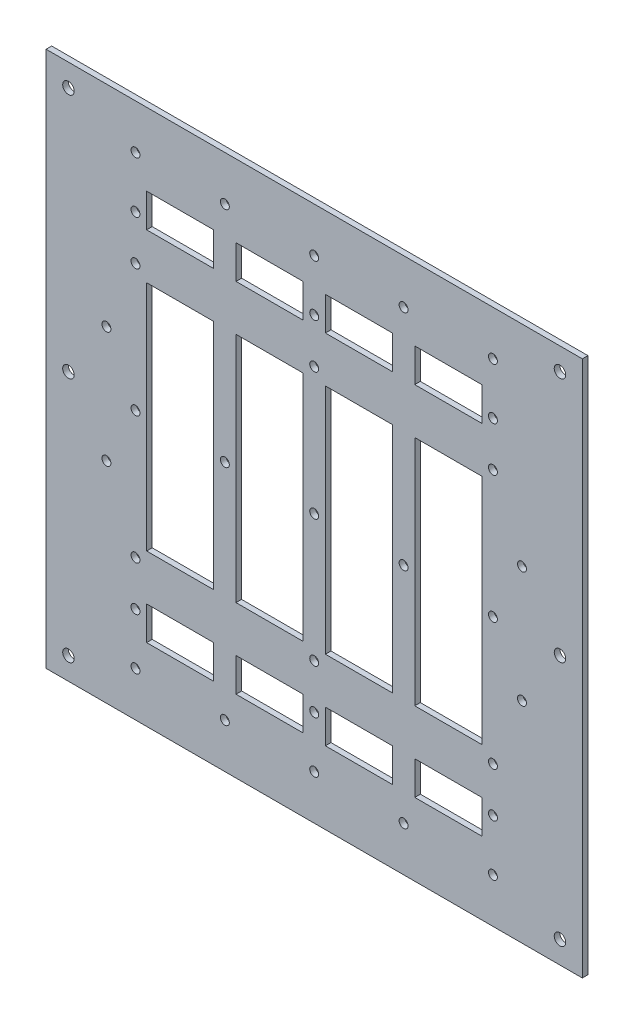
from build123d import *

# Parameters (mm, degrees)
SKETCH1_W           = 304.8
SKETCH1_H           = 304.8
SKETCH1_R           = 2.54
SKETCH1_R_2         = 3.2639
SKETCH1_W_2         = 38.1
SKETCH1_H_2         = 132.08
SKETCH1_H_3         = 19.05
BOSS_EXTRUDE1_DEPTH = 3.175


with BuildPart() as part:
    # Sketch1 → Boss-Extrude1 (new body)
    with BuildSketch(Plane.XY):
        Rectangle(SKETCH1_W, SKETCH1_H)
        with Locations((-101.6, 0)):
            Circle(SKETCH1_R, mode=Mode.SUBTRACT)
        with Locations((-50.8, 0)):
            Circle(SKETCH1_R, mode=Mode.SUBTRACT)
        Circle(SKETCH1_R, mode=Mode.SUBTRACT)
        with Locations((101.6, 0)):
            Circle(SKETCH1_R, mode=Mode.SUBTRACT)
        with Locations((50.8, 0)):
            Circle(SKETCH1_R, mode=Mode.SUBTRACT)
        with Locations((-50.8, 127)):
            Circle(SKETCH1_R, mode=Mode.SUBTRACT)
        with Locations((0, 127)):
            Circle(SKETCH1_R, mode=Mode.SUBTRACT)
        with Locations((50.8, 127)):
            Circle(SKETCH1_R, mode=Mode.SUBTRACT)
        with Locations((-101.6, 72.39)):
            Circle(SKETCH1_R, mode=Mode.SUBTRACT)
        with Locations((0, 72.39)):
            Circle(SKETCH1_R, mode=Mode.SUBTRACT)
        with Locations((101.6, 72.39)):
            Circle(SKETCH1_R, mode=Mode.SUBTRACT)
        with Locations((-101.6, -72.39)):
            Circle(SKETCH1_R, mode=Mode.SUBTRACT)
        with Locations((0, -72.39)):
            Circle(SKETCH1_R, mode=Mode.SUBTRACT)
        with Locations((101.6, -72.39)):
            Circle(SKETCH1_R, mode=Mode.SUBTRACT)
        with Locations((50.8, -127)):
            Circle(SKETCH1_R, mode=Mode.SUBTRACT)
        with Locations((0, -127)):
            Circle(SKETCH1_R, mode=Mode.SUBTRACT)
        with Locations((-50.8, -127)):
            Circle(SKETCH1_R, mode=Mode.SUBTRACT)
        with Locations((-101.6, 97.79)):
            Circle(SKETCH1_R, mode=Mode.SUBTRACT)
        with Locations((0, 97.79)):
            Circle(SKETCH1_R, mode=Mode.SUBTRACT)
        with Locations((101.6, 97.79)):
            Circle(SKETCH1_R, mode=Mode.SUBTRACT)
        with Locations((101.6, 127)):
            Circle(SKETCH1_R, mode=Mode.SUBTRACT)
        with Locations((-101.6, 127)):
            Circle(SKETCH1_R, mode=Mode.SUBTRACT)
        with Locations((-118.11, 33.02)):
            Circle(SKETCH1_R, mode=Mode.SUBTRACT)
        with Locations((-101.6, -127)):
            Circle(SKETCH1_R, mode=Mode.SUBTRACT)
        with Locations((101.6, -127)):
            Circle(SKETCH1_R, mode=Mode.SUBTRACT)
        with Locations((101.6, -97.79)):
            Circle(SKETCH1_R, mode=Mode.SUBTRACT)
        with Locations((0, -97.79)):
            Circle(SKETCH1_R, mode=Mode.SUBTRACT)
        with Locations((-101.6, -97.79)):
            Circle(SKETCH1_R, mode=Mode.SUBTRACT)
        with Locations((-118.11, -33.02)):
            Circle(SKETCH1_R, mode=Mode.SUBTRACT)
        with Locations((-139.7, 139.7)):
            Circle(SKETCH1_R_2, mode=Mode.SUBTRACT)
        with Locations((-139.7, 0)):
            Circle(SKETCH1_R_2, mode=Mode.SUBTRACT)
        with Locations((-139.7, -139.7)):
            Circle(SKETCH1_R_2, mode=Mode.SUBTRACT)
        with Locations((139.7, -139.7)):
            Circle(SKETCH1_R_2, mode=Mode.SUBTRACT)
        with Locations((139.7, 0)):
            Circle(SKETCH1_R_2, mode=Mode.SUBTRACT)
        with Locations((139.7, 139.7)):
            Circle(SKETCH1_R_2, mode=Mode.SUBTRACT)
        with Locations((118.11, -33.02)):
            Circle(SKETCH1_R, mode=Mode.SUBTRACT)
        with Locations((118.11, 33.02)):
            Circle(SKETCH1_R, mode=Mode.SUBTRACT)
        with Locations((-76.2, 0)):
            Rectangle(SKETCH1_W_2, SKETCH1_H_2, mode=Mode.SUBTRACT)
        with Locations((-25.4, 0)):
            Rectangle(SKETCH1_W_2, SKETCH1_H_2, mode=Mode.SUBTRACT)
        with Locations((25.4, 0)):
            Rectangle(SKETCH1_W_2, SKETCH1_H_2, mode=Mode.SUBTRACT)
        with Locations((76.2, 0)):
            Rectangle(SKETCH1_W_2, SKETCH1_H_2, mode=Mode.SUBTRACT)
        with Locations((-25.4, 101.6)):
            Rectangle(SKETCH1_W_2, SKETCH1_H_3, mode=Mode.SUBTRACT)
        with Locations((-76.2, 101.6)):
            Rectangle(SKETCH1_W_2, SKETCH1_H_3, mode=Mode.SUBTRACT)
        with Locations((76.2, 101.6)):
            Rectangle(SKETCH1_W_2, SKETCH1_H_3, mode=Mode.SUBTRACT)
        with Locations((25.4, 101.6)):
            Rectangle(SKETCH1_W_2, SKETCH1_H_3, mode=Mode.SUBTRACT)
        with Locations((-76.2, -101.6)):
            Rectangle(SKETCH1_W_2, SKETCH1_H_3, mode=Mode.SUBTRACT)
        with Locations((-25.4, -101.6)):
            Rectangle(SKETCH1_W_2, SKETCH1_H_3, mode=Mode.SUBTRACT)
        with Locations((25.4, -101.6)):
            Rectangle(SKETCH1_W_2, SKETCH1_H_3, mode=Mode.SUBTRACT)
        with Locations((76.2, -101.6)):
            Rectangle(SKETCH1_W_2, SKETCH1_H_3, mode=Mode.SUBTRACT)
    extrude(amount=BOSS_EXTRUDE1_DEPTH)


solid = part.part
